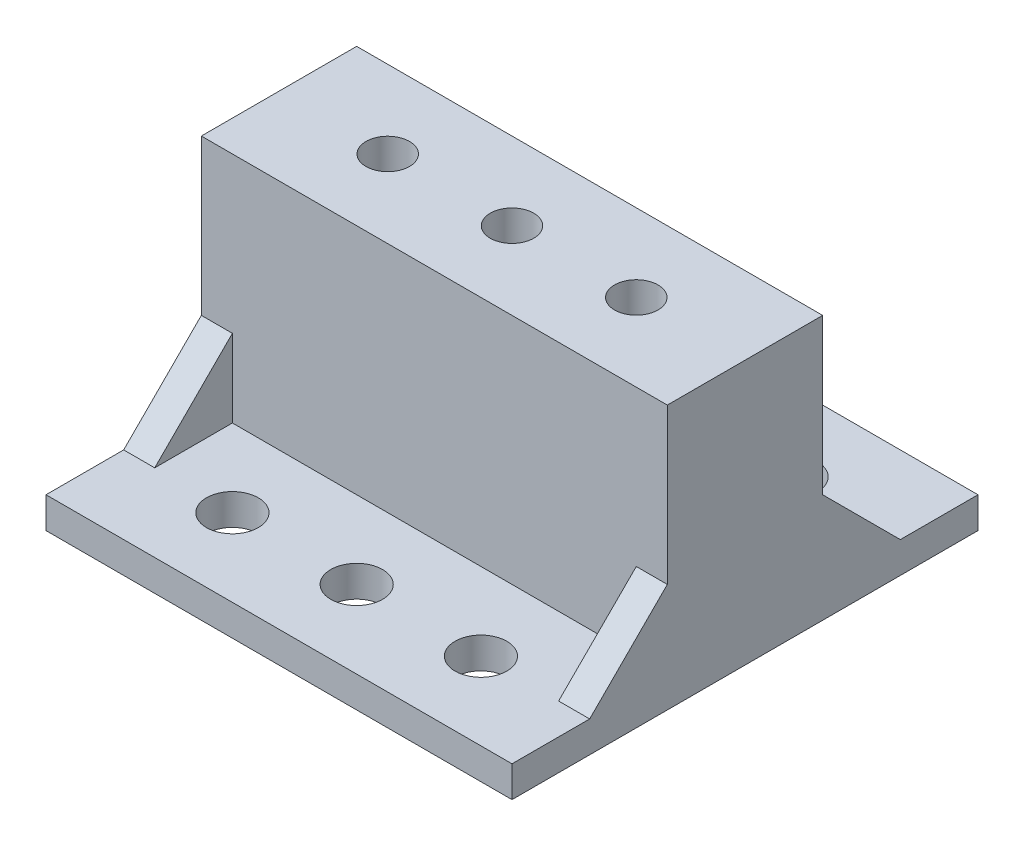
from build123d import *

# Parameters (mm, degrees)
CROQUIS1_W                = 45
CROQUIS1_H                = 45
SALIENTE_EXTRUIR1_DEPTH   = 3
CROQUIS2_W                = 45
CROQUIS2_H                = 15
SALIENTE_EXTRUIR2_DEPTH   = 22.5
SALIENTE_EXTRUIR3_DEPTH   = 3
SIMETR_A2_COPY_1_DEPTH    = 3
CROQUIS4_R                = 2.5
CORTAR_EXTRUIR1_DEPTH     = 3
TALADRO_ROSCADO_M51_D     = 4.2
TALADRO_ROSCADO_M51_DEPTH = 18
TALADRO_ROSCADO_M51_TIP   = 1.2618073


with BuildPart() as part:
    # Croquis1 → Saliente-Extruir1 (new body)
    with BuildSketch(Plane(origin=(0, 0, 0), x_dir=(1, 0, 0), z_dir=(0, 1, 0))):
        Rectangle(CROQUIS1_W, CROQUIS1_H)
    extrude(amount=SALIENTE_EXTRUIR1_DEPTH)

    # Croquis2 → Saliente-Extruir2 (add)
    with BuildSketch(Plane(origin=(0, 3, 0), x_dir=(1, 0, 0), z_dir=(0, 1, 0))):
        Rectangle(CROQUIS2_W, CROQUIS2_H)
    extrude(amount=SALIENTE_EXTRUIR2_DEPTH)

    # Croquis3 → Saliente-Extruir3 (add)
    with BuildSketch(Plane.ZY.offset(22.5)):
        Polygon((7.5, 3), (15, 3), (7.5, 10.5), align=None)
    saliente_extruir3 = extrude(amount=-SALIENTE_EXTRUIR3_DEPTH)

    # Simetría1: Saliente-Extruir3 across plane
    add(saliente_extruir3.mirror(Plane(origin=(0, 0, 0), x_dir=(0, 0, 1), z_dir=(1, 0, 0))))

    # Simetría2: Saliente-Extruir3 across plane
    add(saliente_extruir3.mirror(Plane.XY))

    # Simetría2 copy 1 sketch → Simetría2 copy 1 (add)
    with BuildSketch(Plane(origin=(22.5, 0, 0), x_dir=(0, 0, -1), z_dir=(1, 0, 0))):
        Polygon((7.5, 3), (15, 3), (7.5, 10.5), align=None)
    extrude(amount=-SIMETR_A2_COPY_1_DEPTH)

    # Croquis4 → Cortar-Extruir1 (cut)
    with BuildSketch(Plane(origin=(0, 3, 0), x_dir=(1, 0, 0), z_dir=(0, 1, 0))):
        with Locations(Location((0, -15, 0), (0, 0, 270))):
            Circle(CROQUIS4_R)
        with Locations(Location((-12, -15, 0), (0, 0, 270))):
            Circle(CROQUIS4_R)
        with Locations(Location((12, -15, 0), (0, 0, 270))):
            Circle(CROQUIS4_R)
    cortar_extruir1 = extrude(amount=-CORTAR_EXTRUIR1_DEPTH, mode=Mode.SUBTRACT)

    # Simetría3: Cortar-Extruir1 across plane
    add(cortar_extruir1.mirror(Plane.XY), mode=Mode.SUBTRACT)

    # Taladro roscado M51
    with Locations(Plane(origin=(0, 25.5, 0), x_dir=(1, 0, 0), z_dir=(0, 1, 0))):
        with Locations((0, 0), (12, 0), (-12, 0)):
            Hole(TALADRO_ROSCADO_M51_D / 2, depth=TALADRO_ROSCADO_M51_DEPTH)
            with Locations((0, 0, -(TALADRO_ROSCADO_M51_DEPTH + TALADRO_ROSCADO_M51_TIP / 2))):  # 118° drill point
                Cone(0, TALADRO_ROSCADO_M51_D / 2, TALADRO_ROSCADO_M51_TIP, mode=Mode.SUBTRACT)


solid = part.part
